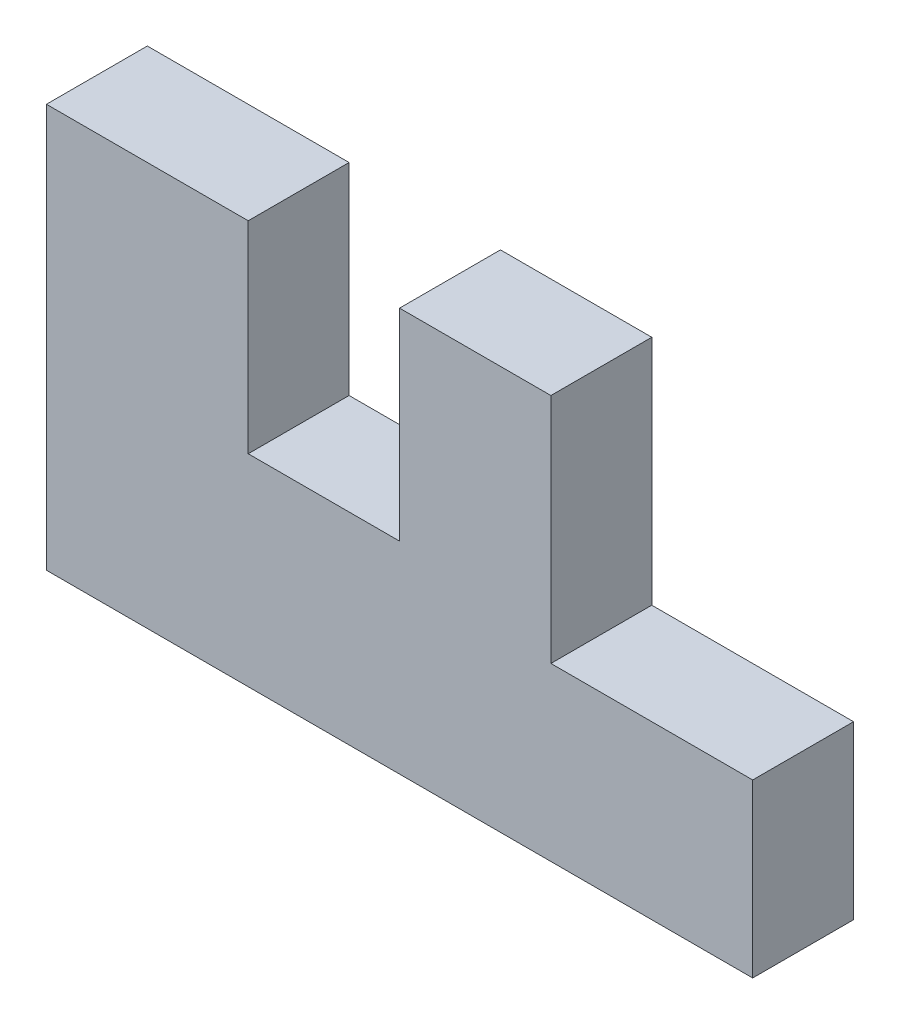
from build123d import *

# Parameters (mm, degrees)
BOSS_EXTRUDE1_DEPTH = 12.7


with BuildPart() as part:
    # Sketch1 → Boss-Extrude1 (new body)
    with BuildSketch(Plane.XY):
        Polygon((0, 0), (0, 50.8), (25.4, 50.8), (25.4, 25.4), (44.45, 25.4), (44.45, 50.8), (63.5, 50.8), (63.5, 21.59), (88.9, 21.59), (88.9, 0), align=None)
    extrude(amount=BOSS_EXTRUDE1_DEPTH)


solid = part.part
